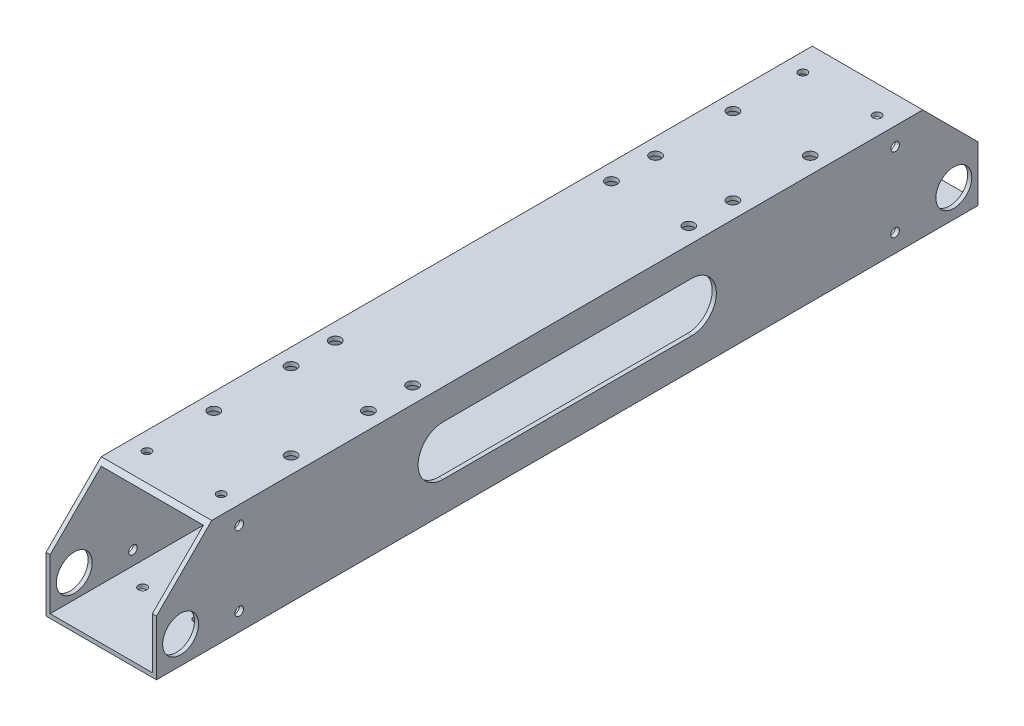
from build123d import *

# Parameters (mm, degrees)
SKETCH_1_W          = 40
SKETCH_1_H          = 40
SKETCH_1_W_2        = 37
SKETCH_1_H_2        = 37
EXTRUDE_1_DEPTH     = 148.75
SKETCH_2_R          = 6.5
CUT_EXTRUDE_1_DEPTH = 45
SKETCH_3_R          = 2.025
CUT_EXTRUDE_2_DEPTH = 50
SKETCH_4_R          = 3.75
CUT_EXTRUDE_3_DEPTH = 3
SKETCH_5_R          = 2.025
CUT_EXTRUDE_4_DEPTH = 60
SKETCH_6_R          = 3.75
CUT_EXTRUDE_5_DEPTH = 3
SKETCH_7_R          = 1.55
CUT_EXTRUDE_6_DEPTH = 55
SKETCH_8_R          = 1.525
CUT_EXTRUDE_7_DEPTH = 20
SKETCH_9_R          = 1.525
CUT_EXTRUDE_8_DEPTH = 3


with BuildPart() as part:
    # 草图1 → 凸台-拉伸1 (new, symmetric)
    with BuildSketch(Plane.XY):
        Rectangle(SKETCH_1_W, SKETCH_1_H)
        Rectangle(SKETCH_1_W_2, SKETCH_1_H_2, mode=Mode.SUBTRACT)
    extrude(amount=EXTRUDE_1_DEPTH, both=True)

    # 草图2 → 切除-拉伸1 (cut)
    with BuildSketch(Plane(origin=(20, 0, 0), x_dir=(0, 0, -1), z_dir=(1, 0, 0))):
        with Locations(Location((-140, -10, 0), (0, 0, 90))):
            Circle(SKETCH_2_R)
        with Locations(Location((140, -10, 0), (0, 0, 90))):
            Circle(SKETCH_2_R)
        Polygon((-148.75, 0), (-128.75, 20), (-148.75, 20), align=None)
        with BuildLine():
            Line((-45, 9), (45, 9))
            ThreePointArc((45, 9), (54, 0), (45, -9))
            Line((45, -9), (-45, -9))
            ThreePointArc((-45, -9), (-54, 0), (-45, 9))
        make_face()
        Polygon((128.75, 20), (148.75, 20), (148.75, 0), align=None)
    extrude(amount=-CUT_EXTRUDE_1_DEPTH, mode=Mode.SUBTRACT)

    # 草图3 → 切除-拉伸2 (cut)
    with BuildSketch(Plane(origin=(0, 20, 0), x_dir=(1, 0, 0), z_dir=(0, 1, 0))):
        with Locations(Location((-14, 50, 0), (0, 0, 270))):
            Circle(SKETCH_3_R)
        with Locations(Location((14, 50, 0), (0, 0, 270))):
            Circle(SKETCH_3_R)
        with Locations(Location((14, -50, 0), (0, 0, 270))):
            Circle(SKETCH_3_R)
        with Locations(Location((-14, -50, 0), (0, 0, 270))):
            Circle(SKETCH_3_R)
    extrude(amount=-CUT_EXTRUDE_2_DEPTH, mode=Mode.SUBTRACT)

    # 草图4 → 切除-拉伸3 (cut)
    with BuildSketch(Plane.XZ.offset(20)):
        with Locations(Location((-14, 50, 0), (0, 0, 270))):
            Circle(SKETCH_4_R)
        with Locations(Location((14, 50, 0), (0, 0, 270))):
            Circle(SKETCH_4_R)
        with Locations(Location((-14, -50, 0), (0, 0, 270))):
            Circle(SKETCH_4_R)
        with Locations(Location((14, -50, 0), (0, 0, 270))):
            Circle(SKETCH_4_R)
    extrude(amount=-CUT_EXTRUDE_3_DEPTH, mode=Mode.SUBTRACT)

    # 草图5 → 切除-拉伸4 (cut)
    with BuildSketch(Plane(origin=(0, 20, 0), x_dir=(1, 0, 0), z_dir=(0, 1, 0))):
        with Locations(Location((-14, 94, 0), (0, 0, 270))):
            Circle(SKETCH_5_R)
        with Locations(Location((14, 94, 0), (0, 0, 270))):
            Circle(SKETCH_5_R)
        with Locations(Location((14, 66, 0), (0, 0, 270))):
            Circle(SKETCH_5_R)
        with Locations(Location((-14, 66, 0), (0, 0, 270))):
            Circle(SKETCH_5_R)
    cut_extrude_4 = extrude(amount=-CUT_EXTRUDE_4_DEPTH, mode=Mode.SUBTRACT)

    # 草图6 → 切除-拉伸5 (cut)
    with BuildSketch(Plane.XZ.offset(20)):
        with Locations(Location((-14, -66, 0), (0, 0, 270))):
            Circle(SKETCH_6_R)
        with Locations(Location((14, -66, 0), (0, 0, 270))):
            Circle(SKETCH_6_R)
        with Locations(Location((-14, -94, 0), (0, 0, 270))):
            Circle(SKETCH_6_R)
        with Locations(Location((14, -94, 0), (0, 0, 270))):
            Circle(SKETCH_6_R)
    cut_extrude_5 = extrude(amount=-CUT_EXTRUDE_5_DEPTH, mode=Mode.SUBTRACT)

    # 镜向1: 切除-拉伸4, 切除-拉伸5 across plane
    add(cut_extrude_4.mirror(Plane.XY), mode=Mode.SUBTRACT)
    add(cut_extrude_5.mirror(Plane.XY), mode=Mode.SUBTRACT)

    # 草图7 → 切除-拉伸6 (cut)
    with BuildSketch(Plane.ZY.offset(20)):
        with Locations(Location((-118.75, 13.45, 0), (0, 0, 270))):
            Circle(SKETCH_7_R)
        with Locations(Location((-118.75, -13.45, 0), (0, 0, 270))):
            Circle(SKETCH_7_R)
    cut_extrude_6 = extrude(amount=-CUT_EXTRUDE_6_DEPTH, mode=Mode.SUBTRACT)

    # 草图8 → 切除-拉伸7 (cut)
    with BuildSketch(Plane(origin=(0, 20, 0), x_dir=(1, 0, 0), z_dir=(0, 1, 0))):
        with Locations(Location((-13.45, 118.75, 0), (0, 0, 270))):
            Circle(SKETCH_8_R)
        with Locations(Location((13.45, 118.75, 0), (0, 0, 270))):
            Circle(SKETCH_8_R)
    cut_extrude_7 = extrude(amount=-CUT_EXTRUDE_7_DEPTH, mode=Mode.SUBTRACT)

    # 镜向2: 切除-拉伸6, 切除-拉伸7 across plane
    add(cut_extrude_6.mirror(Plane.XY), mode=Mode.SUBTRACT)
    add(cut_extrude_7.mirror(Plane.XY), mode=Mode.SUBTRACT)

    # 草图9 → 切除-拉伸8 (cut)
    with BuildSketch(Plane.XZ.offset(20)):
        with Locations((-10, -123.75)):
            Circle(SKETCH_9_R)
        with Locations((10, -123.75)):
            Circle(SKETCH_9_R)
        with Locations(Location((10, 123.75, 0), (0, 0, 90))):
            Circle(SKETCH_9_R)
        with Locations(Location((-10, 123.75, 0), (0, 0, 90))):
            Circle(SKETCH_9_R)
    extrude(amount=-CUT_EXTRUDE_8_DEPTH, mode=Mode.SUBTRACT)


solid = part.part
